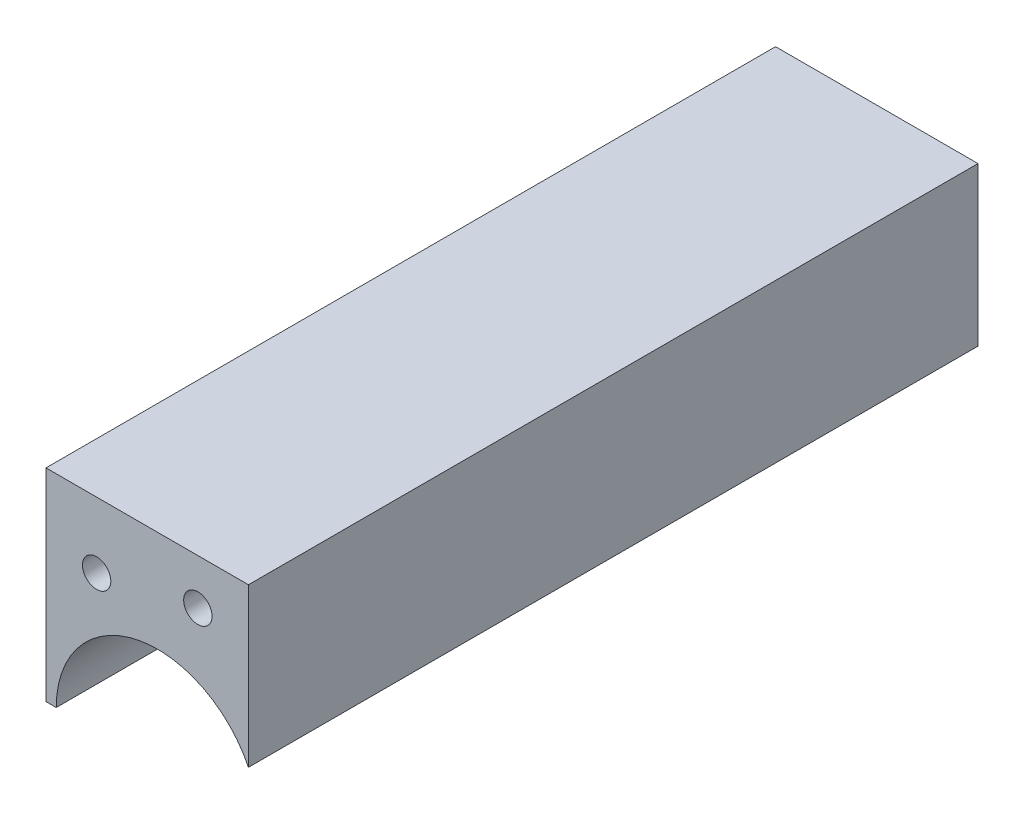
from build123d import *

# Parameters (mm, degrees)
SKETCH1_R           = 1.4
BOSS_EXTRUDE1_DEPTH = 72.07


with BuildPart() as part:
    # Sketch1 → Boss-Extrude1 (new body)
    with BuildSketch(Plane.XY):
        with BuildLine():
            Line((0, 0), (1.01, 0))
            ThreePointArc((1.01, 0), (8.762779495, 9.744229061), (20, 4.379486271))
            Line((20, 4.379486271), (20, 20))
            Line((20, 20), (0, 20))
            Line((0, 20), (0, 0))
        make_face()
        with Locations(Location((5, 13.5, 0), (0, 0, 180))):
            Circle(SKETCH1_R, mode=Mode.SUBTRACT)
        with Locations(Location((15, 15.5, 0), (0, 0, 180))):
            Circle(SKETCH1_R, mode=Mode.SUBTRACT)
    extrude(amount=BOSS_EXTRUDE1_DEPTH)


solid = part.part
